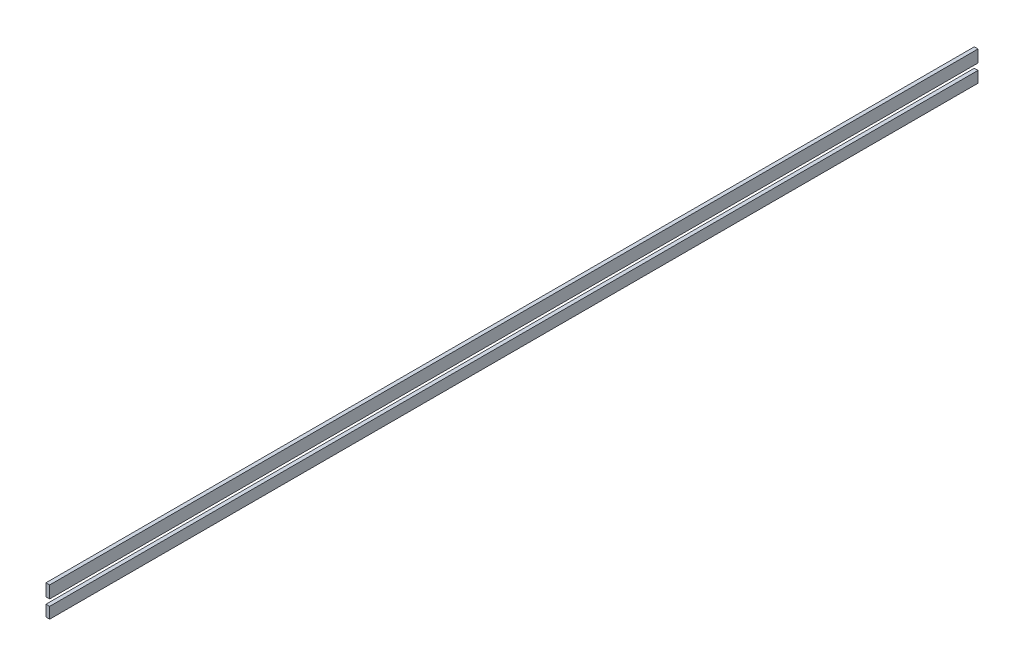
from build123d import *

# Parameters (mm, degrees)
BOSS_EXTRUDE1_DEPTH        = 250
BOSS_EXTRUDE1_DEPTH_BACK   = 250
SKETCH1_W                  = 2
SKETCH1_H                  = 6.571428571
BOSS_EXTRUDE1_2_DEPTH      = 250
BOSS_EXTRUDE1_2_DEPTH_BACK = 250
SKETCH1_H_2                = 6


with BuildPart() as part:
    # Sketch1 → Boss-Extrude1 (new, two sides: drawn at the far end of the back side and taken through both)
    with BuildSketch(Plane.XY.offset(-BOSS_EXTRUDE1_DEPTH_BACK)):
        with Locations((0, 4.714285714)):
            Rectangle(SKETCH1_W, SKETCH1_H)
    extrude(amount=BOSS_EXTRUDE1_DEPTH + BOSS_EXTRUDE1_DEPTH_BACK)


with BuildPart() as body_2:
    # Sketch1 → Boss-Extrude1 2 (new, two sides: drawn at the far end of the back side and taken through both)
    with BuildSketch(Plane.XY.offset(-BOSS_EXTRUDE1_2_DEPTH_BACK)):
        with Locations((0, -5)):
            Rectangle(SKETCH1_W, SKETCH1_H_2)
    extrude(amount=BOSS_EXTRUDE1_2_DEPTH + BOSS_EXTRUDE1_2_DEPTH_BACK)


solid = Compound([part.part, body_2.part])
